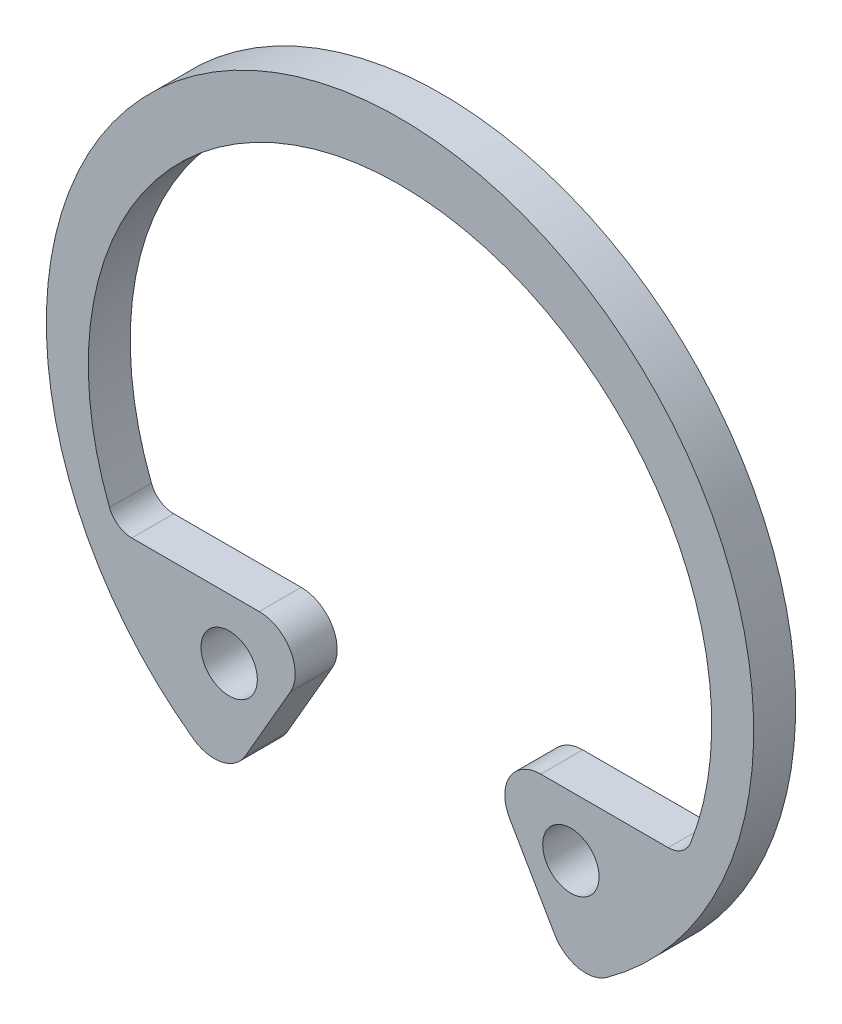
from build123d import *

# Parameters (mm, degrees)
SKETCH1_R           = 0.5969
BOSS_EXTRUDE1_DEPTH = 0.889


with BuildPart() as part:
    # Sketch1 → Boss-Extrude1 (new body)
    with BuildSketch(Plane.XY):
        with BuildLine():
            Line((-5.68137307, -3.048), (-2.981745785, -3.048))
            ThreePointArc((-2.981745785, -3.048), (-2.321834428, -3.429), (-2.321834428, -4.191))
            Line((-2.321834428, -4.191), (-3.275039722, -5.842))
            ThreePointArc((-3.275039722, -5.842), (-3.775058057, -6.206035718), (-4.38041724, -6.079226415))
            ThreePointArc((-4.38041724, -6.079226415), (0, 7.493), (4.38041724, -6.079226415))
            ThreePointArc((4.38041724, -6.079226415), (3.775058057, -6.206035718), (3.275039722, -5.842))
            Line((3.275039722, -5.842), (2.321834428, -4.191))
            ThreePointArc((2.321834428, -4.191), (2.321834428, -3.429), (2.981745785, -3.048))
            Line((2.981745785, -3.048), (5.68137307, -3.048))
            ThreePointArc((5.68137307, -3.048), (5.968179451, -2.95929238), (6.154820826, -2.72415))
            ThreePointArc((6.154820826, -2.72415), (0, 6.2738), (-6.154820826, -2.72415))
            ThreePointArc((-6.154820826, -2.72415), (-5.968179451, -2.95929238), (-5.68137307, -3.048))
        make_face()
        with Locations((-3.6195, -4.318)):
            Circle(SKETCH1_R, mode=Mode.SUBTRACT)
        with Locations(Location((3.6195, -4.318, 0), (0, 0, 180))):
            Circle(SKETCH1_R, mode=Mode.SUBTRACT)
    extrude(amount=BOSS_EXTRUDE1_DEPTH)


solid = part.part
